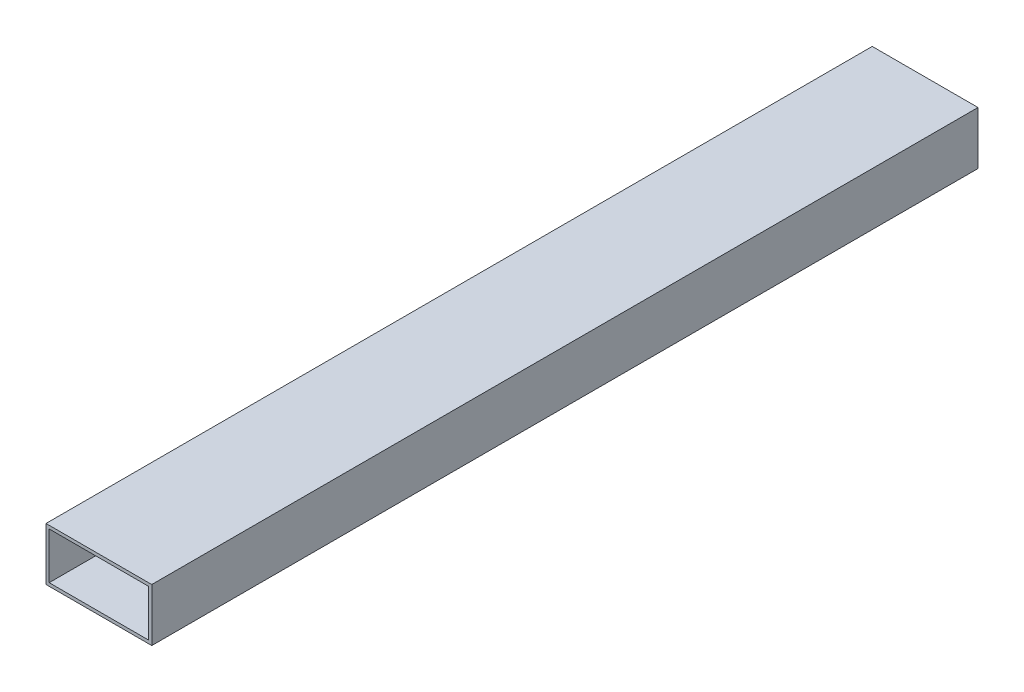
from build123d import *

# Parameters (mm, degrees)
SKETCH1_W           = 50.8
SKETCH1_H           = 25.4
SKETCH1_W_2         = 47.752
SKETCH1_H_2         = 22.352
EXTRUDE_THIN1_DEPTH = 396.875


with BuildPart() as part:
    # Sketch1 → Extrude-Thin1 (new body)
    with BuildSketch(Plane.XY):
        with Locations((-106.682879913, 35.377134372)):
            Rectangle(SKETCH1_W, SKETCH1_H)
        with Locations((-106.682879913, 35.377134372)):
            Rectangle(SKETCH1_W_2, SKETCH1_H_2, mode=Mode.SUBTRACT)
    extrude(amount=EXTRUDE_THIN1_DEPTH)


solid = part.part
